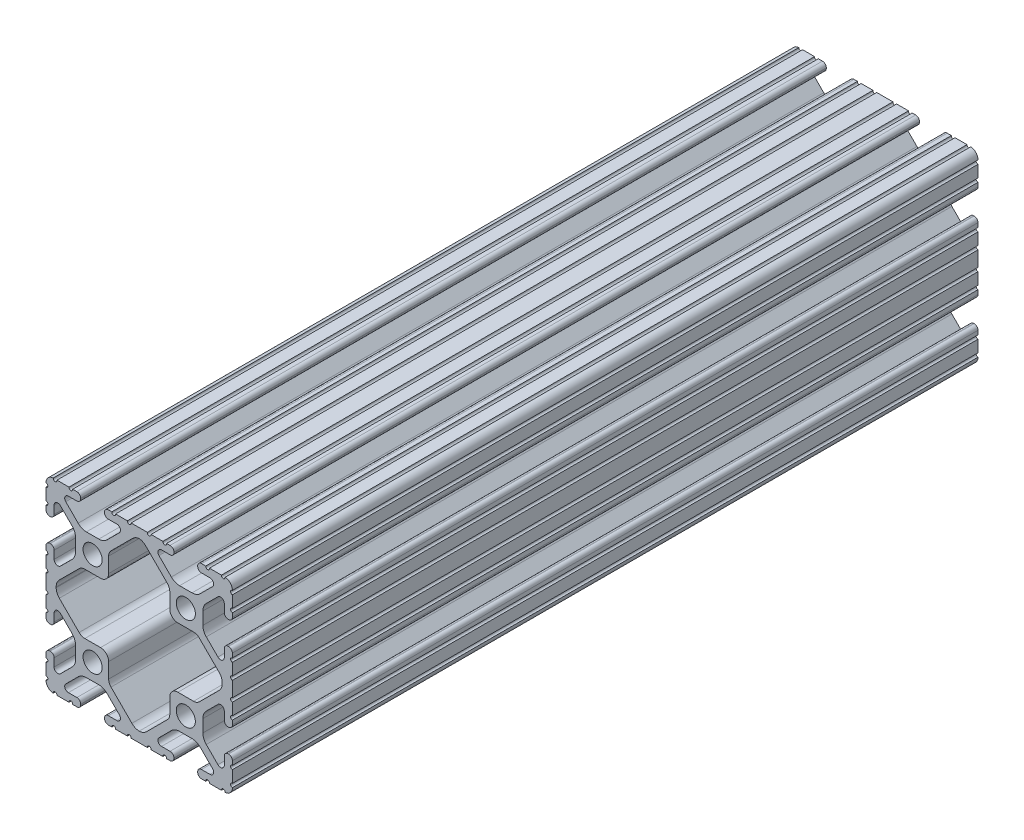
from build123d import *

# Parameters (mm, degrees)
SKETCH1_R           = 2.6035
BOSS_EXTRUDE1_DEPTH = 101.6


with BuildPart() as part:
    # Sketch1 → Boss-Extrude1 (new, symmetric)
    with BuildSketch(Plane.XY):
        with BuildLine():
            Line((7.45792614, -25.4), (8.405130016, -25.4))
            ThreePointArc((8.405130016, -25.4), (9.151169169, -25.100362415), (9.461500022, -24.358707602))
            Line((9.461500022, -24.358707602), (9.461500022, -24.231492399))
            ThreePointArc((9.461500022, -24.231492399), (9.151169171, -23.489837577), (8.405130016, -23.1902))
            Line((8.405130016, -23.1902), (6.087754002, -23.1902))
            ThreePointArc((6.087754002, -23.1902), (5.173448619, -22.579280675), (5.387974958, -21.500783941))
            Line((5.387974958, -21.500783941), (8.763022929, -18.12573597))
            ThreePointArc((8.763022929, -18.12573597), (9.793067061, -17.437482484), (11.008086959, -17.1958))
            Line((11.008086959, -17.1958), (14.391913041, -17.1958))
            ThreePointArc((14.391913041, -17.1958), (15.606932939, -17.437482484), (16.636977071, -18.12573597))
            Line((16.636977071, -18.12573597), (20.012025042, -21.500783941))
            ThreePointArc((20.012025042, -21.500783941), (20.223734168, -22.586011733), (19.297652818, -23.190092399))
            Line((19.297652818, -23.190092399), (16.9799, -23.190092399))
            ThreePointArc((16.9799, -23.190092399), (16.243518998, -23.495111397), (15.9385, -24.231492399))
            Line((15.9385, -24.231492399), (15.9385, -24.358707602))
            ThreePointArc((15.9385, -24.358707602), (16.248830571, -25.100362128), (16.994869211, -25.4))
            Line((16.994869211, -25.4), (18.134015685, -25.4))
            ThreePointArc((18.134015685, -25.4), (18.636212411, -24.815433371), (19.138409137, -25.4))
            Line((19.138409137, -25.4), (22.413213213, -25.4))
            ThreePointArc((22.413213213, -25.4), (22.915409939, -24.815433371), (23.417606664, -25.4))
            Line((23.417606664, -25.4), (23.450057096, -25.4))
            ThreePointArc((23.450057096, -25.4), (24.837463446, -24.731428565), (25.4, -23.29774975))
            Line((25.4, -23.29774975), (25.4, -23.268649529))
            ThreePointArc((25.4, -23.268649529), (24.892, -22.760649529), (25.4, -22.252649529))
            Line((25.4, -22.252649529), (25.4, -19.025239356))
            ThreePointArc((25.4, -19.025239356), (24.892, -18.517239356), (25.4, -18.009239356))
            Line((25.4, -18.009239356), (25.4, -16.91604181))
            ThreePointArc((25.4, -16.91604181), (25.094981002, -16.179660808), (24.3586, -15.87464181))
            Line((24.3586, -15.87464181), (24.2316, -15.87464181))
            ThreePointArc((24.2316, -15.87464181), (23.495218998, -16.179660808), (23.1902, -16.91604181))
            Line((23.1902, -16.91604181), (23.1902, -19.100988789))
            ThreePointArc((23.1902, -19.100988789), (22.563006367, -20.039650394), (21.45577951, -19.819409279))
            Line((21.45577951, -19.819409279), (18.27813597, -16.641765738))
            ThreePointArc((18.27813597, -16.641765738), (17.589882484, -15.611721606), (17.3482, -14.396701708))
            Line((17.3482, -14.396701708), (17.3482, -11.003495043))
            ThreePointArc((17.3482, -11.003495043), (17.590610762, -9.786718415), (18.280827, -8.755743204))
            Line((18.280827, -8.755743204), (21.45664064, -5.587529241))
            ThreePointArc((21.45664064, -5.587529241), (22.563568521, -5.368381274), (23.1902, -6.30680983))
            Line((23.1902, -6.30680983), (23.1902, -8.48395819))
            ThreePointArc((23.1902, -8.48395819), (23.495218998, -9.220339192), (24.2316, -9.52535819))
            Line((24.2316, -9.52535819), (24.3586, -9.52535819))
            ThreePointArc((24.3586, -9.52535819), (25.094981002, -9.220339192), (25.4, -8.48395819))
            Line((25.4, -8.48395819), (25.4, -7.327686685))
            ThreePointArc((25.4, -7.327686685), (24.892, -6.819686685), (25.4, -6.311686685))
            Line((25.4, -6.311686685), (25.4, -3.084276513))
            ThreePointArc((25.4, -3.084276513), (24.892, -2.576276513), (25.4, -2.068276513))
            Line((25.4, -2.068276513), (25.4, 2.068276513))
            ThreePointArc((25.4, 2.068276513), (24.892, 2.576276513), (25.4, 3.084276513))
            Line((25.4, 3.084276513), (25.4, 6.311686685))
            ThreePointArc((25.4, 6.311686685), (24.892, 6.819686685), (25.4, 7.327686685))
            Line((25.4, 7.327686685), (25.4, 8.48395819))
            ThreePointArc((25.4, 8.48395819), (25.094981002, 9.220339192), (24.3586, 9.52535819))
            Line((24.3586, 9.52535819), (24.2316, 9.52535819))
            ThreePointArc((24.2316, 9.52535819), (23.495218998, 9.220339192), (23.1902, 8.48395819))
            Line((23.1902, 8.48395819), (23.1902, 6.30680983))
            ThreePointArc((23.1902, 6.30680983), (22.563568521, 5.368381274), (21.45664064, 5.587529241))
            Line((21.45664064, 5.587529241), (18.280827, 8.755743204))
            ThreePointArc((18.280827, 8.755743204), (17.590610762, 9.786718415), (17.3482, 11.003495043))
            Line((17.3482, 11.003495043), (17.3482, 14.396701708))
            ThreePointArc((17.3482, 14.396701708), (17.589882484, 15.611721606), (18.27813597, 16.641765738))
            Line((18.27813597, 16.641765738), (21.45577951, 19.819409279))
            ThreePointArc((21.45577951, 19.819409279), (22.563006367, 20.039650394), (23.1902, 19.100988789))
            Line((23.1902, 19.100988789), (23.1902, 16.91604181))
            ThreePointArc((23.1902, 16.91604181), (23.495218998, 16.179660808), (24.2316, 15.87464181))
            Line((24.2316, 15.87464181), (24.3586, 15.87464181))
            ThreePointArc((24.3586, 15.87464181), (25.094981002, 16.179660808), (25.4, 16.91604181))
            Line((25.4, 16.91604181), (25.4, 18.009239356))
            ThreePointArc((25.4, 18.009239356), (24.892, 18.517239356), (25.4, 19.025239356))
            Line((25.4, 19.025239356), (25.4, 22.252649529))
            ThreePointArc((25.4, 22.252649529), (24.892, 22.760649529), (25.4, 23.268649529))
            Line((25.4, 23.268649529), (25.4, 23.29774975))
            ThreePointArc((25.4, 23.29774975), (24.837462256, 24.73142746), (23.450057096, 25.4))
            Line((23.450057096, 25.4), (23.417606664, 25.4))
            ThreePointArc((23.417606664, 25.4), (22.915409939, 24.815433371), (22.413213213, 25.4))
            Line((22.413213213, 25.4), (19.138409137, 25.4))
            ThreePointArc((19.138409137, 25.4), (18.636212411, 24.815433371), (18.134015685, 25.4))
            Line((18.134015685, 25.4), (16.994869211, 25.4))
            ThreePointArc((16.994869211, 25.4), (16.248830563, 25.100362136), (15.9385, 24.358707602))
            Line((15.9385, 24.358707602), (15.9385, 24.231492399))
            ThreePointArc((15.9385, 24.231492399), (16.243518998, 23.495111397), (16.9799, 23.190092399))
            Line((16.9799, 23.190092399), (19.297652818, 23.190092399))
            ThreePointArc((19.297652818, 23.190092399), (20.223734168, 22.586011733), (20.012025042, 21.500783941))
            Line((20.012025042, 21.500783941), (16.636977071, 18.12573597))
            ThreePointArc((16.636977071, 18.12573597), (15.606932939, 17.437482484), (14.391913041, 17.1958))
            Line((14.391913041, 17.1958), (11.008086959, 17.1958))
            ThreePointArc((11.008086959, 17.1958), (9.793067061, 17.437482484), (8.763022929, 18.12573597))
            Line((8.763022929, 18.12573597), (5.387974958, 21.500783941))
            ThreePointArc((5.387974958, 21.500783941), (5.173448619, 22.579280675), (6.087754002, 23.1902))
            Line((6.087754002, 23.1902), (8.405130016, 23.1902))
            ThreePointArc((8.405130016, 23.1902), (9.151169155, 23.489837593), (9.4615, 24.231492399))
            Line((9.4615, 24.231492399), (9.4615, 24.358707602))
            ThreePointArc((9.4615, 24.358707602), (9.151169154, 25.100362399), (8.405130016, 25.4))
            Line((8.405130016, 25.4), (7.45792614, 25.4))
            ThreePointArc((7.45792614, 25.4), (6.955729414, 24.815433371), (6.453532688, 25.4))
            Line((6.453532688, 25.4), (3.214515968, 25.4))
            ThreePointArc((3.214515968, 25.4), (2.712319242, 24.815433371), (2.210122516, 25.4))
            Line((2.210122516, 25.4), (-2.210122516, 25.4))
            ThreePointArc((-2.210122516, 25.4), (-2.712319242, 24.815433371), (-3.214515968, 25.4))
            Line((-3.214515968, 25.4), (-6.453532688, 25.4))
            ThreePointArc((-6.453532688, 25.4), (-6.955729414, 24.815433371), (-7.45792614, 25.4))
            Line((-7.45792614, 25.4), (-8.405130016, 25.4))
            ThreePointArc((-8.405130016, 25.4), (-9.151169169, 25.100362415), (-9.461500022, 24.358707602))
            Line((-9.461500022, 24.358707602), (-9.461500022, 24.231492399))
            ThreePointArc((-9.461500022, 24.231492399), (-9.151169171, 23.489837577), (-8.405130016, 23.1902))
            Line((-8.405130016, 23.1902), (-6.087754002, 23.1902))
            ThreePointArc((-6.087754002, 23.1902), (-5.173448619, 22.579280675), (-5.387974958, 21.500783941))
            Line((-5.387974958, 21.500783941), (-8.763022929, 18.12573597))
            ThreePointArc((-8.763022929, 18.12573597), (-9.793067061, 17.437482484), (-11.008086959, 17.1958))
            Line((-11.008086959, 17.1958), (-14.391913041, 17.1958))
            ThreePointArc((-14.391913041, 17.1958), (-15.606932939, 17.437482484), (-16.636977071, 18.12573597))
            Line((-16.636977071, 18.12573597), (-20.012025042, 21.500783941))
            ThreePointArc((-20.012025042, 21.500783941), (-20.223734168, 22.586011733), (-19.297652818, 23.190092399))
            Line((-19.297652818, 23.190092399), (-16.9799, 23.190092399))
            ThreePointArc((-16.9799, 23.190092399), (-16.243518998, 23.495111397), (-15.9385, 24.231492399))
            Line((-15.9385, 24.231492399), (-15.9385, 24.358707602))
            ThreePointArc((-15.9385, 24.358707602), (-16.248830571, 25.100362128), (-16.994869211, 25.4))
            Line((-16.994869211, 25.4), (-18.134015685, 25.4))
            ThreePointArc((-18.134015685, 25.4), (-18.636212411, 24.815433371), (-19.138409137, 25.4))
            Line((-19.138409137, 25.4), (-22.413213213, 25.4))
            ThreePointArc((-22.413213213, 25.4), (-22.915409939, 24.815433371), (-23.417606664, 25.4))
            Line((-23.417606664, 25.4), (-23.450057096, 25.4))
            ThreePointArc((-23.450057096, 25.4), (-24.837463446, 24.731428565), (-25.4, 23.29774975))
            Line((-25.4, 23.29774975), (-25.4, 23.268649529))
            ThreePointArc((-25.4, 23.268649529), (-24.892, 22.760649529), (-25.4, 22.252649529))
            Line((-25.4, 22.252649529), (-25.4, 19.025239356))
            ThreePointArc((-25.4, 19.025239356), (-24.892, 18.517239356), (-25.4, 18.009239356))
            Line((-25.4, 18.009239356), (-25.4, 16.91604181))
            ThreePointArc((-25.4, 16.91604181), (-25.094981002, 16.179660808), (-24.3586, 15.87464181))
            Line((-24.3586, 15.87464181), (-24.2316, 15.87464181))
            ThreePointArc((-24.2316, 15.87464181), (-23.495218998, 16.179660808), (-23.1902, 16.91604181))
            Line((-23.1902, 16.91604181), (-23.1902, 19.100988789))
            ThreePointArc((-23.1902, 19.100988789), (-22.563006367, 20.039650394), (-21.45577951, 19.819409279))
            Line((-21.45577951, 19.819409279), (-18.27813597, 16.641765738))
            ThreePointArc((-18.27813597, 16.641765738), (-17.589882484, 15.611721606), (-17.3482, 14.396701708))
            Line((-17.3482, 14.396701708), (-17.3482, 11.003495043))
            ThreePointArc((-17.3482, 11.003495043), (-17.590610762, 9.786718415), (-18.280827, 8.755743204))
            Line((-18.280827, 8.755743204), (-21.45664064, 5.587529241))
            ThreePointArc((-21.45664064, 5.587529241), (-22.563568521, 5.368381274), (-23.1902, 6.30680983))
            Line((-23.1902, 6.30680983), (-23.1902, 8.48395819))
            ThreePointArc((-23.1902, 8.48395819), (-23.495218998, 9.220339192), (-24.2316, 9.52535819))
            Line((-24.2316, 9.52535819), (-24.3586, 9.52535819))
            ThreePointArc((-24.3586, 9.52535819), (-25.094981002, 9.220339192), (-25.4, 8.48395819))
            Line((-25.4, 8.48395819), (-25.4, 7.327686685))
            ThreePointArc((-25.4, 7.327686685), (-24.892, 6.819686685), (-25.4, 6.311686685))
            Line((-25.4, 6.311686685), (-25.4, 3.084276513))
            ThreePointArc((-25.4, 3.084276513), (-24.892, 2.576276513), (-25.4, 2.068276513))
            Line((-25.4, 2.068276513), (-25.4, -2.068276513))
            ThreePointArc((-25.4, -2.068276513), (-24.892, -2.576276513), (-25.4, -3.084276513))
            Line((-25.4, -3.084276513), (-25.4, -6.311686685))
            ThreePointArc((-25.4, -6.311686685), (-24.892, -6.819686685), (-25.4, -7.327686685))
            Line((-25.4, -7.327686685), (-25.4, -8.48395819))
            ThreePointArc((-25.4, -8.48395819), (-25.094981002, -9.220339192), (-24.3586, -9.52535819))
            Line((-24.3586, -9.52535819), (-24.2316, -9.52535819))
            ThreePointArc((-24.2316, -9.52535819), (-23.495218998, -9.220339192), (-23.1902, -8.48395819))
            Line((-23.1902, -8.48395819), (-23.1902, -6.30680983))
            ThreePointArc((-23.1902, -6.30680983), (-22.563568521, -5.368381274), (-21.45664064, -5.587529241))
            Line((-21.45664064, -5.587529241), (-18.280827, -8.755743204))
            ThreePointArc((-18.280827, -8.755743204), (-17.590610762, -9.786718415), (-17.3482, -11.003495043))
            Line((-17.3482, -11.003495043), (-17.3482, -14.396701708))
            ThreePointArc((-17.3482, -14.396701708), (-17.589882484, -15.611721606), (-18.27813597, -16.641765738))
            Line((-18.27813597, -16.641765738), (-21.45577951, -19.819409279))
            ThreePointArc((-21.45577951, -19.819409279), (-22.563006367, -20.039650394), (-23.1902, -19.100988789))
            Line((-23.1902, -19.100988789), (-23.1902, -16.91604181))
            ThreePointArc((-23.1902, -16.91604181), (-23.495218998, -16.179660808), (-24.2316, -15.87464181))
            Line((-24.2316, -15.87464181), (-24.3586, -15.87464181))
            ThreePointArc((-24.3586, -15.87464181), (-25.094981002, -16.179660808), (-25.4, -16.91604181))
            Line((-25.4, -16.91604181), (-25.4, -18.009239356))
            ThreePointArc((-25.4, -18.009239356), (-24.892, -18.517239356), (-25.4, -19.025239356))
            Line((-25.4, -19.025239356), (-25.4, -22.252649529))
            ThreePointArc((-25.4, -22.252649529), (-24.892, -22.760649529), (-25.4, -23.268649529))
            Line((-25.4, -23.268649529), (-25.4, -23.29774975))
            ThreePointArc((-25.4, -23.29774975), (-24.837462256, -24.73142746), (-23.450057096, -25.4))
            Line((-23.450057096, -25.4), (-23.417606664, -25.4))
            ThreePointArc((-23.417606664, -25.4), (-22.915409939, -24.815433371), (-22.413213213, -25.4))
            Line((-22.413213213, -25.4), (-19.138409137, -25.4))
            ThreePointArc((-19.138409137, -25.4), (-18.636212411, -24.815433371), (-18.134015685, -25.4))
            Line((-18.134015685, -25.4), (-16.994869211, -25.4))
            ThreePointArc((-16.994869211, -25.4), (-16.248830563, -25.100362136), (-15.9385, -24.358707602))
            Line((-15.9385, -24.358707602), (-15.9385, -24.231492399))
            ThreePointArc((-15.9385, -24.231492399), (-16.243518998, -23.495111397), (-16.9799, -23.190092399))
            Line((-16.9799, -23.190092399), (-19.297652818, -23.190092399))
            ThreePointArc((-19.297652818, -23.190092399), (-20.223734168, -22.586011733), (-20.012025042, -21.500783941))
            Line((-20.012025042, -21.500783941), (-16.636977071, -18.12573597))
            ThreePointArc((-16.636977071, -18.12573597), (-15.606932939, -17.437482484), (-14.391913041, -17.1958))
            Line((-14.391913041, -17.1958), (-11.008086959, -17.1958))
            ThreePointArc((-11.008086959, -17.1958), (-9.793067061, -17.437482484), (-8.763022929, -18.12573597))
            Line((-8.763022929, -18.12573597), (-5.387974958, -21.500783941))
            ThreePointArc((-5.387974958, -21.500783941), (-5.173448619, -22.579280675), (-6.087754002, -23.1902))
            Line((-6.087754002, -23.1902), (-8.405130016, -23.1902))
            ThreePointArc((-8.405130016, -23.1902), (-9.151169155, -23.489837593), (-9.4615, -24.231492399))
            Line((-9.4615, -24.231492399), (-9.4615, -24.358707602))
            ThreePointArc((-9.4615, -24.358707602), (-9.151169154, -25.100362399), (-8.405130016, -25.4))
            Line((-8.405130016, -25.4), (-7.45792614, -25.4))
            ThreePointArc((-7.45792614, -25.4), (-6.955729414, -24.815433371), (-6.453532688, -25.4))
            Line((-6.453532688, -25.4), (-3.214515968, -25.4))
            ThreePointArc((-3.214515968, -25.4), (-2.712319242, -24.815433371), (-2.210122516, -25.4))
            Line((-2.210122516, -25.4), (2.210122516, -25.4))
            ThreePointArc((2.210122516, -25.4), (2.712319242, -24.815433371), (3.214515968, -25.4))
            Line((3.214515968, -25.4), (6.453532688, -25.4))
            ThreePointArc((6.453532688, -25.4), (6.955729414, -24.815433371), (7.45792614, -25.4))
        make_face()
        with Locations((-12.7, 12.7)):
            Circle(SKETCH1_R, mode=Mode.SUBTRACT)
        with Locations((12.7, 12.7)):
            Circle(SKETCH1_R, mode=Mode.SUBTRACT)
        with Locations((12.7, -12.7)):
            Circle(SKETCH1_R, mode=Mode.SUBTRACT)
        with Locations((-12.7, -12.7)):
            Circle(SKETCH1_R, mode=Mode.SUBTRACT)
        with BuildLine():
            Line((-7.683964565, -16.079665203), (-1.987770861, -21.775858908))
            ThreePointArc((-1.987770861, -21.775858908), (-1.075921771, -22.393947165), (0, -22.630366707))
            ThreePointArc((0, -22.630366707), (1.075921771, -22.393947165), (1.987770861, -21.775858908))
            Line((1.987770861, -21.775858908), (7.683964565, -16.079665203))
            ThreePointArc((7.683964565, -16.079665203), (8.162988991, -15.362754487), (8.3312, -14.517100638))
            Line((8.3312, -14.517100638), (8.3312, -10.3886))
            ThreePointArc((8.3312, -10.3886), (8.978435435, -8.826035435), (10.541, -8.1788))
            Line((10.541, -8.1788), (14.816495758, -8.1788))
            ThreePointArc((14.816495758, -8.1788), (15.66092662, -8.01109514), (16.377187366, -7.53343528))
            Line((16.377187366, -7.53343528), (21.77338316, -2.150152507))
            ThreePointArc((21.77338316, -2.150152507), (22.408382099, -1.201655313), (22.6314, -0.082220815))
            Line((22.6314, -0.082220815), (22.6314, 0.082220815))
            ThreePointArc((22.6314, 0.082220815), (22.408382099, 1.201655313), (21.77338316, 2.150152507))
            Line((21.77338316, 2.150152507), (16.376754096, 7.533867514))
            ThreePointArc((16.376754096, 7.533867514), (15.660493349, 8.011527374), (14.816062488, 8.179232234))
            Line((14.816062488, 8.179232234), (10.541, 8.179232234))
            ThreePointArc((10.541, 8.179232234), (8.978435435, 8.826467669), (8.3312, 10.389032234))
            Line((8.3312, 10.389032234), (8.3312, 14.517100638))
            ThreePointArc((8.3312, 14.517100638), (8.162988991, 15.362754487), (7.683964565, 16.079665203))
            Line((7.683964565, 16.079665203), (1.795557487, 21.968072281))
            ThreePointArc((1.795557487, 21.968072281), (0.97153248, 22.546678968), (0, 22.811117151))
            ThreePointArc((0, 22.811117151), (-0.97153248, 22.546678968), (-1.795557487, 21.968072281))
            Line((-1.795557487, 21.968072281), (-7.683964565, 16.079665203))
            ThreePointArc((-7.683964565, 16.079665203), (-8.162988991, 15.362754487), (-8.3312, 14.517100638))
            Line((-8.3312, 14.517100638), (-8.3312, 10.3886))
            ThreePointArc((-8.3312, 10.3886), (-8.978435435, 8.826035435), (-10.541, 8.1788))
            Line((-10.541, 8.1788), (-14.816495758, 8.1788))
            ThreePointArc((-14.816495758, 8.1788), (-15.66092662, 8.01109514), (-16.377187366, 7.53343528))
            Line((-16.377187366, 7.53343528), (-21.77338316, 2.150152507))
            ThreePointArc((-21.77338316, 2.150152507), (-22.408382099, 1.201655313), (-22.6314, 0.082220815))
            Line((-22.6314, 0.082220815), (-22.6314, -0.082220815))
            ThreePointArc((-22.6314, -0.082220815), (-22.408382099, -1.201655313), (-21.77338316, -2.150152507))
            Line((-21.77338316, -2.150152507), (-16.377187366, -7.53343528))
            ThreePointArc((-16.377187366, -7.53343528), (-15.66092662, -8.01109514), (-14.816495758, -8.1788))
            Line((-14.816495758, -8.1788), (-10.541, -8.1788))
            ThreePointArc((-10.541, -8.1788), (-8.978435435, -8.826035435), (-8.3312, -10.3886))
            Line((-8.3312, -10.3886), (-8.3312, -14.517100638))
            ThreePointArc((-8.3312, -14.517100638), (-8.162988991, -15.362754487), (-7.683964565, -16.079665203))
        make_face(mode=Mode.SUBTRACT)
    extrude(amount=BOSS_EXTRUDE1_DEPTH, both=True)


solid = part.part
